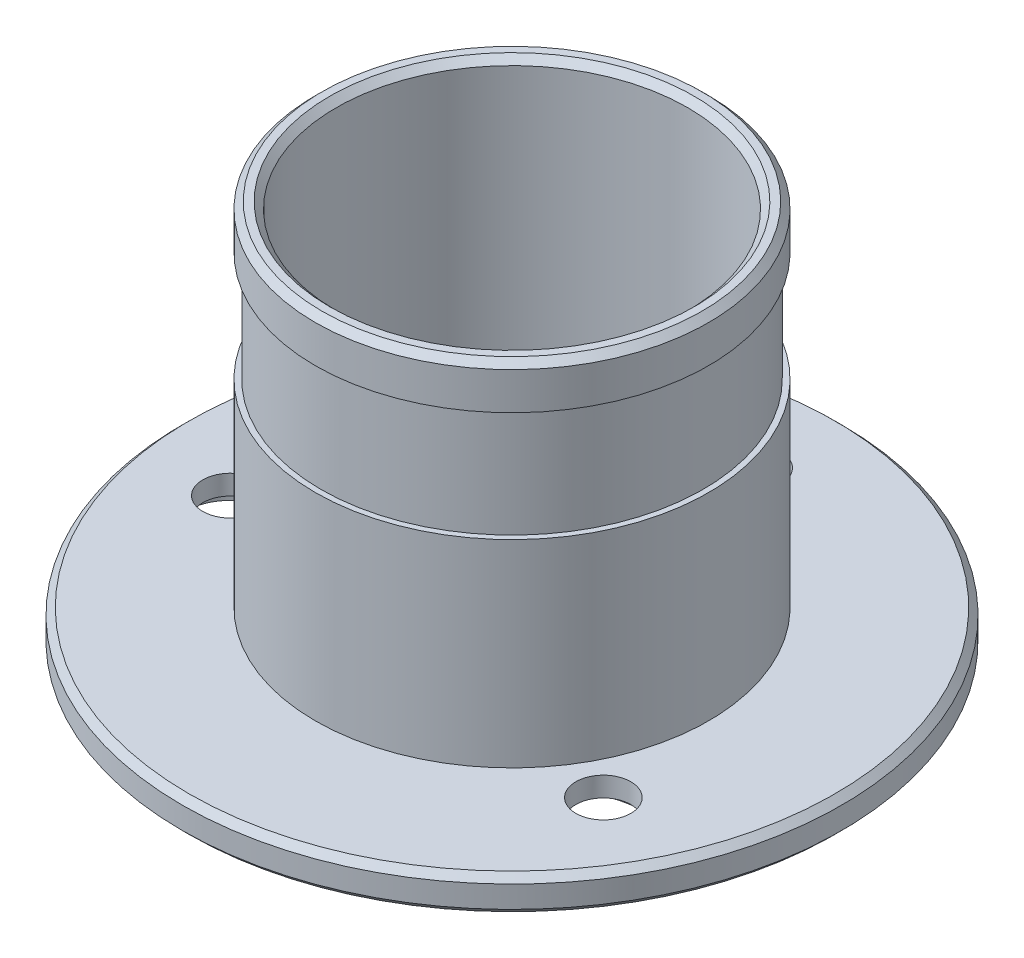
from build123d import *

# Parameters (mm, degrees)
SKETCH_1_R          = 15
EXTRUDE_1_DEPTH     = 1.6
SKETCH_2_R          = 8.95
EXTRUDE_2_DEPTH     = 16
SKETCH_3_R          = 8
CUT_EXTRUDE_1_DEPTH = 28.563744303
FILLET_1_R          = 2
MM_1_D              = 2.5
SKETCH_6_R          = 2
CUT_EXTRUDE_2_DEPTH = 0.7
CUT_EXTRUDE_START   = -7
SKETCH_7_R          = 8.95
SKETCH_7_R_2        = 8.7
CUT_EXTRUDE_3_DEPTH = 5
CHAMFER_1_SIZE      = 0.3


with BuildPart() as part:
    # 草图1 → 凸台-拉伸1 (new body)
    with BuildSketch(Plane(origin=(0, 0, 0), x_dir=(1, 0, 0), z_dir=(0, 1, 0))):
        with Locations(Location((0, 0, 0), (0, 0, 270))):
            Circle(SKETCH_1_R)
    extrude(amount=EXTRUDE_1_DEPTH)

    # 草图2 → 凸台-拉伸2 (add)
    with BuildSketch(Plane(origin=(0, 1.6, 0), x_dir=(1, 0, 0), z_dir=(0, 1, 0))):
        with Locations(Location((0, 0, 0), (0, 0, 270))):
            Circle(SKETCH_2_R)
    extrude(amount=EXTRUDE_2_DEPTH)

    # 草图3 → 切除-拉伸1 (cut, through all)
    with BuildSketch(Plane(origin=(0, 0, 0), x_dir=(-1, 0, 0), z_dir=(0, -1, 0))):
        with Locations(Location((0, 0, 0), (0, 0, 90))):
            Circle(SKETCH_3_R)
    extrude(amount=-CUT_EXTRUDE_1_DEPTH, mode=Mode.SUBTRACT)

    # 圆角1
    fillet_1_edges = [part.edges().sort_by_distance(p)[0] for p in [
        (0, 0, 8),
    ]]
    fillet(fillet_1_edges, radius=FILLET_1_R)

    # 大小mm 暗销孔1 (through all)
    with Locations(Plane(origin=(0, 1.6, 0), x_dir=(1, 0, 0), z_dir=(0, 1, 0))):
        with Locations((0, 11), (9.573912655, -5.416659161), (-10.815803983, -2.00459078)):
            Hole(MM_1_D / 2)

    # 草图6 → 切除-拉伸2 (cut)
    with BuildSketch(Plane(origin=(0, 0, 0), x_dir=(-1, 0, 0), z_dir=(0, -1, 0))):
        with Locations(Location((0, 11, 0), (0, 0, 90))):
            Circle(SKETCH_6_R)
        with Locations(Location((10.815803983, -2.00459078, 0), (0, 0, 90))):
            Circle(SKETCH_6_R)
        with Locations(Location((-9.573912655, -5.416659161, 0), (0, 0, 90))):
            Circle(SKETCH_6_R)
    extrude(amount=-CUT_EXTRUDE_2_DEPTH, mode=Mode.SUBTRACT)

    # 草图7 → 切除-拉伸3 (cut)
    with BuildSketch(Plane(origin=(0, 17.6, 0), x_dir=(1, 0, 0), z_dir=(0, 1, 0)).offset(CUT_EXTRUDE_START)):
        with Locations(Location((0, 0, 0), (0, 0, 270))):
            Circle(SKETCH_7_R)
        with Locations(Location((0, 0, 0), (0, 0, 270))):
            Circle(SKETCH_7_R_2, mode=Mode.SUBTRACT)
    extrude(amount=CUT_EXTRUDE_3_DEPTH, mode=Mode.SUBTRACT)

    # 倒角1
    chamfer_1_edges = [part.edges().sort_by_distance(p)[0] for p in [
        (0, 17.6, 8),
        (0, 0, -15),
        (0, 1.6, -15),
        (0, 17.6, -8.95),
    ]]
    chamfer(chamfer_1_edges, length=CHAMFER_1_SIZE)


solid = part.part
